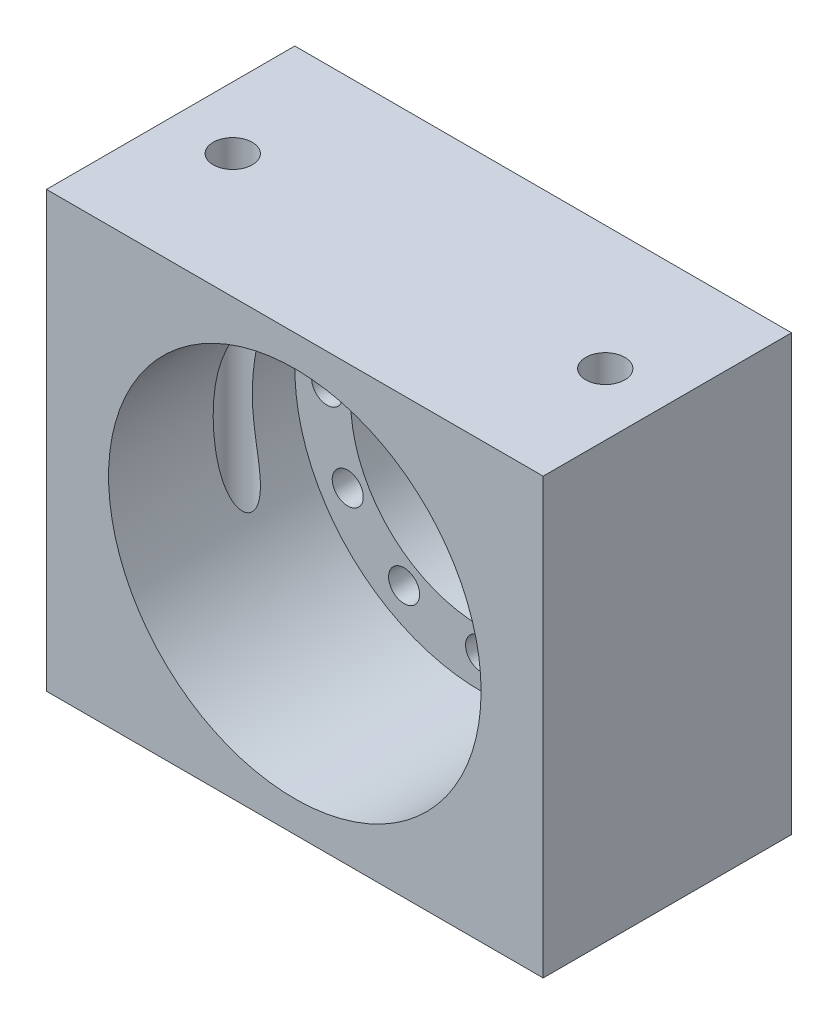
from build123d import *

# Parameters (mm, degrees)
SKETCH1_W           = 50.8
SKETCH1_H           = 44.45
BOSS_EXTRUDE1_DEPTH = 25.4
SKETCH2_R           = 19.05
CUT_EXTRUDE1_DEPTH  = 19.05
SKETCH3_R           = 13.335
SKETCH3_R_2         = 1.5875
CUT_EXTRUDE2_DEPTH  = 71.138042459
SKETCH4_R           = 2
CUT_EXTRUDE3_DEPTH  = 73.122135992


with BuildPart() as part:
    # Sketch1 → Boss-Extrude1 (new body)
    with BuildSketch(Plane.XY):
        with Locations((25.4, 22.225)):
            Rectangle(SKETCH1_W, SKETCH1_H)
    extrude(amount=BOSS_EXTRUDE1_DEPTH)

    # Sketch2 → Cut-Extrude1 (cut)
    with BuildSketch(Plane.XY.offset(25.4)):
        with Locations((25.4, 22.225)):
            Circle(SKETCH2_R)
    extrude(amount=-CUT_EXTRUDE1_DEPTH, mode=Mode.SUBTRACT)

    # Sketch3 → Cut-Extrude2 (cut, through all)
    with BuildSketch(Plane.XY.offset(6.35)):
        with Locations((25.4, 22.225)):
            Circle(SKETCH3_R)
        with Locations((9.652, 22.225)):
            Circle(SKETCH3_R_2)
        with Locations((11.761831941, 30.099)):
            Circle(SKETCH3_R_2)
        with Locations((17.526, 35.863168059)):
            Circle(SKETCH3_R_2)
        with Locations((25.4, 37.973)):
            Circle(SKETCH3_R_2)
        with Locations((33.274, 35.863168059)):
            Circle(SKETCH3_R_2)
        with Locations((39.038168059, 30.099)):
            Circle(SKETCH3_R_2)
        with Locations((41.148, 22.225)):
            Circle(SKETCH3_R_2)
        with Locations((39.038168059, 14.351)):
            Circle(SKETCH3_R_2)
        with Locations((33.274, 8.586831941)):
            Circle(SKETCH3_R_2)
        with Locations((25.4, 6.477)):
            Circle(SKETCH3_R_2)
        with Locations((17.526, 8.586831941)):
            Circle(SKETCH3_R_2)
        with Locations((11.761831941, 14.351)):
            Circle(SKETCH3_R_2)
    extrude(amount=-CUT_EXTRUDE2_DEPTH, mode=Mode.SUBTRACT)

    # Sketch4 → Cut-Extrude3 (cut, through all)
    with BuildSketch(Plane(origin=(0, 44.45, 0), x_dir=(1, 0, 0), z_dir=(0, 1, 0))):
        with Locations(Location((6.35, -12.7, 0), (0, 0, 270))):
            Circle(SKETCH4_R)
        with Locations(Location((44.45, -12.7, 0), (0, 0, 270))):
            Circle(SKETCH4_R)
    extrude(amount=-CUT_EXTRUDE3_DEPTH, mode=Mode.SUBTRACT)


solid = part.part
